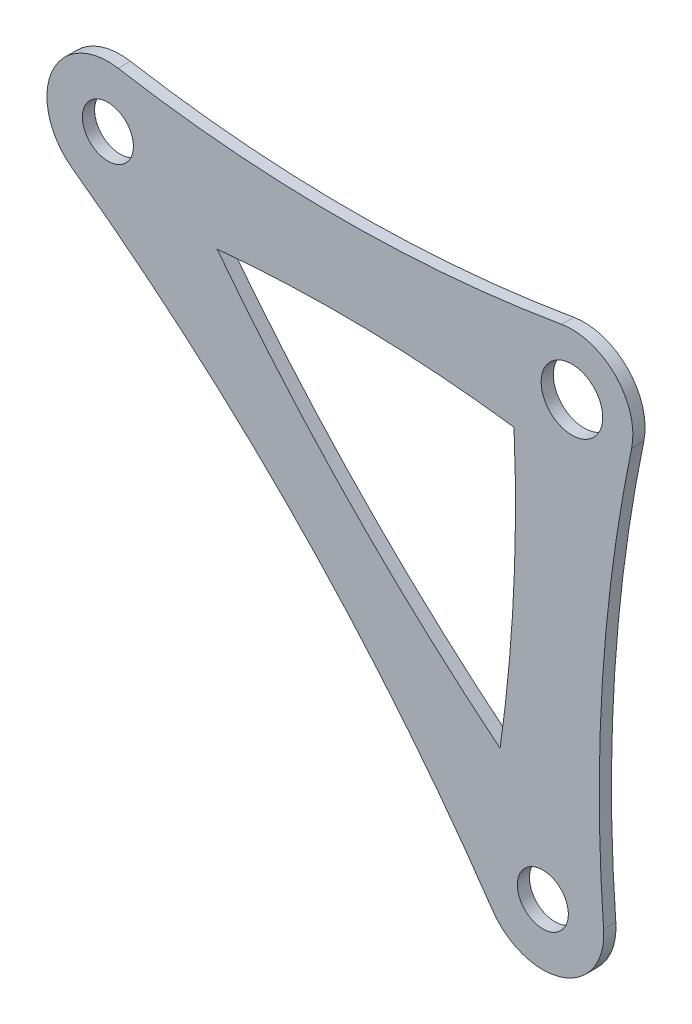
from build123d import *

# Parameters (mm, degrees)
ESQUISSE1_R        = 7.89
ESQUISSE1_R_2      = 3.3
ESQUISSE1_R_3      = 3.985
BOSS_EXTRU_1_DEPTH = 1.58


with BuildPart() as part:
    # Esquisse1 → Boss.-Extru.1 (new body)
    # profile 1 of 9: a face of its own
    with BuildSketch(Plane(origin=(0, 0, 0), x_dir=(0, 1, 0), z_dir=(0, 0, 1))):
        with Locations((-57.907596038, 3.76712371)):
            Circle(ESQUISSE1_R)
        with Locations(Location((-57.907596038, 3.76712371, 0), (0, 0, 90))):
            Circle(ESQUISSE1_R_2, mode=Mode.SUBTRACT)
    # profile 2 of 9: a face of its own
    with BuildSketch(Plane(origin=(0, 0, 0), x_dir=(0, 1, 0), z_dir=(0, 0, 1))):
        with BuildLine():
            ThreePointArc((-62.343020281, 10.292390891), (-59.444168438, 11.506054208), (-56.301538768, 11.491933095))
            ThreePointArc((-56.301538768, 11.491933095), (-50.037335941, 10.293415373), (-43.738103365, 9.295241675))
            ThreePointArc((-43.738103365, 9.295241675), (-25.983312523, 28.716933044), (-6.082429339, 45.932900691))
            ThreePointArc((-6.082429339, 45.932900691), (-6.808122629, 52.346571885), (-7.776764583, 58.728071842))
            ThreePointArc((-7.776764583, 58.728071842), (-7.686126552, 61.842009718), (-6.39725572, 64.678140238))
            ThreePointArc((-6.39725572, 64.678140238), (-31.994708958, 35.041699087), (-62.343020281, 10.292390891))
        make_face()
    # profile 3 of 9: a face of its own
    with BuildSketch(Plane(origin=(0, 0, 0), x_dir=(0, 1, 0), z_dir=(0, 0, 1))):
        with BuildLine():
            ThreePointArc((-56.301538768, 11.491933095), (-51.786979572, 8.746094895), (-50.017596038, 3.76712371))
            ThreePointArc((-50.017596038, 3.76712371), (-50.400051579, 1.340423031), (-51.510340319, -0.851016528))
            ThreePointArc((-51.510340319, -0.851016528), (-47.696280505, 4.277310952), (-43.738103365, 9.295241675))
            ThreePointArc((-43.738103365, 9.295241675), (-50.037335941, 10.293415373), (-56.301538768, 11.491933095))
        make_face()
    # profile 4 of 9: a face of its own
    with BuildSketch(Plane(origin=(0, 0, 0), x_dir=(0, 1, 0), z_dir=(0, 0, 1))):
        with BuildLine():
            ThreePointArc((-43.738103365, 9.295241675), (-47.696280505, 4.277310952), (-51.510340319, -0.851016528))
            ThreePointArc((-51.510340319, -0.851016528), (-54.053844003, -3.117692573), (-57.315900013, -4.100658431))
            ThreePointArc((-57.315900013, -4.100658431), (-29.333901967, -3.959332501), (-1.606057271, -7.724809386))
            ThreePointArc((-1.606057271, -7.724809386), (-6.520388042, -4.442593812), (-7.776764583, 1.331928158))
            ThreePointArc((-7.776764583, 1.331928158), (-7.278629827, 4.40977224), (-6.837025839, 7.496234348))
            ThreePointArc((-6.837025839, 7.496234348), (-25.32919367, 7.541846284), (-43.738103365, 9.295241675))
        make_face()
    # profile 5 of 9: a face of its own
    with BuildSketch(Plane(origin=(0, 0, 0), x_dir=(0, 1, 0), z_dir=(0, 0, 1))):
        with BuildLine():
            ThreePointArc((-0.591696025, 7.867782141), (-3.712908005, 7.657586059), (-6.837025839, 7.496234348))
            ThreePointArc((-6.837025839, 7.496234348), (-7.278629827, 4.40977224), (-7.776764583, 1.331928158))
            ThreePointArc((-7.776764583, 1.331928158), (-5.309155306, 5.836520362), (-0.591696025, 7.867782141))
        make_face()
    # profile 6 of 9: a face of its own
    with BuildSketch(Plane(origin=(0, 0, 0), x_dir=(0, 1, 0), z_dir=(0, 0, 1))):
        Circle(ESQUISSE1_R)
        with Locations(Location((0, 0, 0), (0, 0, 90))):
            Circle(ESQUISSE1_R_3, mode=Mode.SUBTRACT)
    # profile 7 of 9: a face of its own
    with BuildSketch(Plane(origin=(0, 0, 0), x_dir=(0, 1, 0), z_dir=(0, 0, 1))):
        with BuildLine():
            ThreePointArc((-7.776764583, 58.728071842), (-6.808122629, 52.346571885), (-6.082429339, 45.932900691))
            ThreePointArc((-6.082429339, 45.932900691), (-0.878320654, 49.809662788), (4.435424243, 53.534732819))
            ThreePointArc((4.435424243, 53.534732819), (-3.087690297, 52.799265283), (-7.776764583, 58.728071842))
        make_face()
    # profile 8 of 9: a face of its own
    with BuildSketch(Plane(origin=(0, 0, 0), x_dir=(0, 1, 0), z_dir=(0, 0, 1))):
        with Locations((0, 60.06)):
            Circle(ESQUISSE1_R)
        with Locations(Location((0, 60.06, 0), (0, 0, 90))):
            Circle(ESQUISSE1_R_2, mode=Mode.SUBTRACT)
    # profile 9 of 9: a face of its own
    with BuildSketch(Plane(origin=(0, 0, 0), x_dir=(0, 1, 0), z_dir=(0, 0, 1))):
        with BuildLine():
            ThreePointArc((4.435424243, 53.534732819), (-0.878320654, 49.809662788), (-6.082429339, 45.932900691))
            ThreePointArc((-6.082429339, 45.932900691), (-5.369716255, 26.693168194), (-6.837025839, 7.496234348))
            ThreePointArc((-6.837025839, 7.496234348), (-3.712908005, 7.657586059), (-0.591696025, 7.867782141))
            ThreePointArc((-0.591696025, 7.867782141), (4.85650588, 6.218235331), (7.776764583, 1.331928158))
            ThreePointArc((7.776764583, 1.331928158), (5.336964728, 30.03), (7.776764583, 58.728071842))
            ThreePointArc((7.776764583, 58.728071842), (6.635290614, 55.790922996), (4.435424243, 53.534732819))
        make_face()
    extrude(amount=BOSS_EXTRU_1_DEPTH)


solid = part.part
